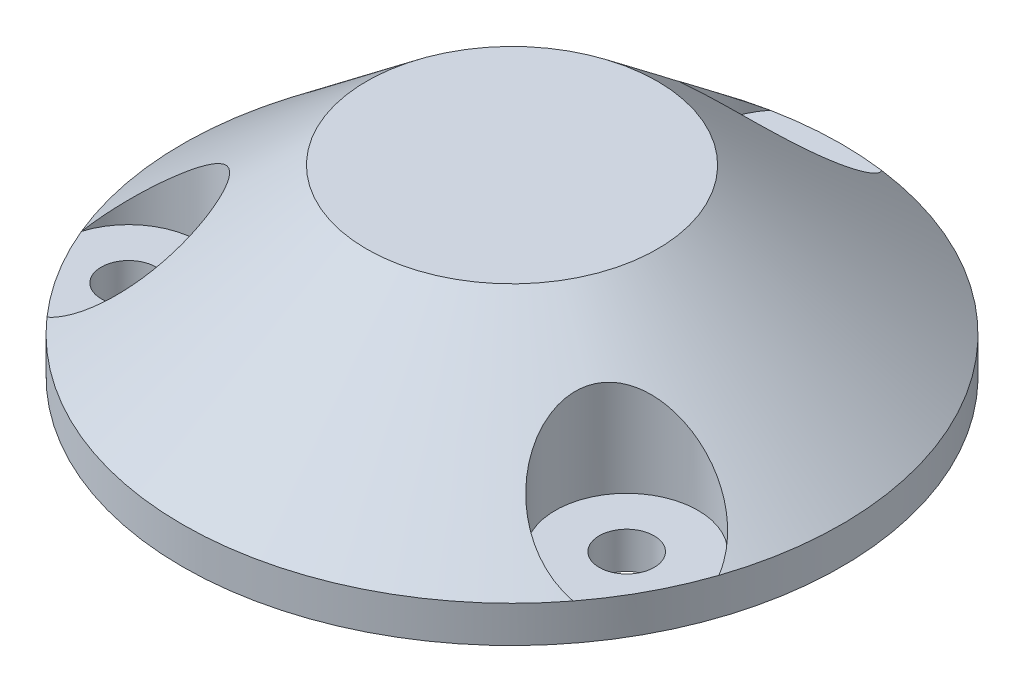
from build123d import *

# Parameters (mm, degrees)
ESQUISSE1_R             = 10.85
ESQUISSE1_R_2           = 9
BOSS_EXTRU_1_DEPTH      = 7
ESQUISSE2_R             = 18
BOSS_EXTRU_2_DEPTH      = 2
ESQUISSE4_R             = 18
BOSS_EXTRU_3_DEPTH      = 8
BOSS_EXTRU_3_TAPER      = 51.5
ESQUISSE5_R             = 1.5
ENL_V_MAT_EXTRU_1_DEPTH = 4
ESQUISSE6_R             = 3.9
ENL_V_MAT_EXTRU_2_DEPTH = 8
ESQUISSE9_R             = 10.85
ENL_V_MAT_EXTRU_4_DEPTH = 7
ESQUISSE10_R            = 9
ENL_V_MAT_EXTRU_5_DEPTH = 8


with BuildPart() as part:
    # Esquisse1 → Boss.-Extru.1 (new body)
    with BuildSketch(Plane(origin=(0, 0, 0), x_dir=(1, 0, 0), z_dir=(0, 1, 0))):
        with Locations(Location((0, 0, 0), (0, 0, 270))):
            Circle(ESQUISSE1_R)
        with Locations(Location((0, 0, 0), (0, 0, 270))):
            Circle(ESQUISSE1_R_2, mode=Mode.SUBTRACT)
    extrude(amount=BOSS_EXTRU_1_DEPTH)

    # Esquisse2 → Boss.-Extru.2 (add)
    with BuildSketch(Plane(origin=(0, 7, 0), x_dir=(1, 0, 0), z_dir=(0, 1, 0))):
        with Locations(Location((0, 0, 0), (0, 0, 270))):
            Circle(ESQUISSE2_R)
    extrude(amount=BOSS_EXTRU_2_DEPTH)

    # Esquisse4 → Boss.-Extru.3 (add)
    with BuildSketch(Plane(origin=(0, 9, 0), x_dir=(1, 0, 0), z_dir=(0, 1, 0))):
        with Locations(Location((0, 0, 0), (0, 0, 270))):
            Circle(ESQUISSE4_R)
    extrude(amount=BOSS_EXTRU_3_DEPTH, taper=BOSS_EXTRU_3_TAPER)

    # Esquisse5 → Enlèv. mat.-Extru.1 (cut)
    with BuildSketch(Plane.XZ.offset(-7)):
        with Locations(Location((-12.898733794, 8.041309999, 0), (0, 0, 270))):
            Circle(ESQUISSE5_R)
        with Locations(Location((13.413345636, 7.149976143, 0), (0, 0, 270))):
            Circle(ESQUISSE5_R)
        with Locations(Location((-0.514611842, -15.191286142, 0), (0, 0, 270))):
            Circle(ESQUISSE5_R)
    extrude(amount=-ENL_V_MAT_EXTRU_1_DEPTH, mode=Mode.SUBTRACT)

    # Esquisse6 → Enlèv. mat.-Extru.2 (cut)
    with BuildSketch(Plane(origin=(0, 17, 0), x_dir=(1, 0, 0), z_dir=(0, 1, 0))):
        with Locations((-0.514611842, 15.191286142)):
            Circle(ESQUISSE6_R)
        with Locations((13.413345636, -7.149976143)):
            Circle(ESQUISSE6_R)
        with Locations((-12.898733794, -8.041309999)):
            Circle(ESQUISSE6_R)
    extrude(amount=-ENL_V_MAT_EXTRU_2_DEPTH, mode=Mode.SUBTRACT)

    # Esquisse9 → Enlèv. mat.-Extru.4 (cut)
    with BuildSketch(Plane.XZ):
        Circle(ESQUISSE9_R)
    extrude(amount=-ENL_V_MAT_EXTRU_4_DEPTH, mode=Mode.SUBTRACT)

    # Esquisse10 → Enlèv. mat.-Extru.5 (cut)
    with BuildSketch(Plane.XZ.offset(-7)):
        with Locations(Location((0, 0, 0), (0, 0, 270))):
            Circle(ESQUISSE10_R)
    extrude(amount=-ENL_V_MAT_EXTRU_5_DEPTH, mode=Mode.SUBTRACT)


solid = part.part
